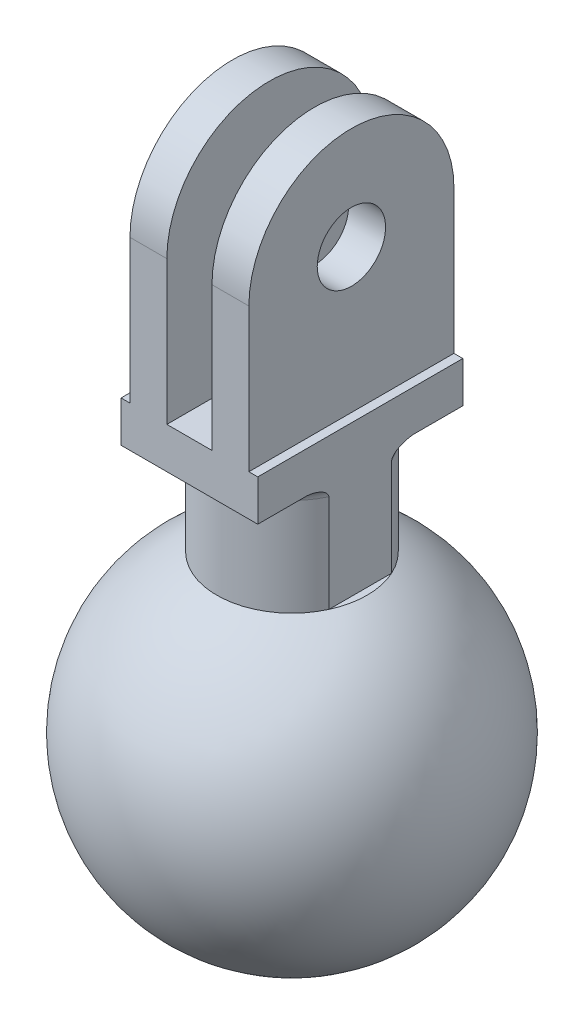
from build123d import *

# Parameters (mm, degrees)
SKETCH2_W           = 10
SKETCH2_H           = 15
BOSS_EXTRUDE1_DEPTH = 3
SKETCH3_W           = 2.7
SKETCH3_H           = 15
BOSS_EXTRUDE2_DEPTH = 18
SKETCH4_R           = 2.5
CUT_EXTRUDE1_DEPTH  = 39.541399757
SKETCH5_W           = 3.267109453
SKETCH5_H           = 13.055369116
SKETCH5_W_2         = 2.399629859
SKETCH5_H_2         = 12.441962392
CUT_EXTRUDE2_DEPTH  = 11


with BuildPart() as part:
    # Sketch1 → Revolve1 (revolve)
    with BuildSketch(Plane.XY, mode=Mode.PRIVATE) as revolve1_sk:
        with BuildLine():
            Line((5.5, 0), (0, 0))
            Line((0, 0), (0, -32.147270417))
            ThreePointArc((0, -32.147270417), (12.382857794, -22.267701741), (5.5, -8))
            Line((5.5, -8), (5.5, -0.86171942))
            Line((5.5, -0.86171942), (5.5, 0))
        make_face()
        with BuildLine():
            Line((6.36171942, 0), (5.5, 0))
            Line((5.5, 0), (5.5, -0.86171942))
            ThreePointArc((5.5, -0.86171942), (5.77082934, -0.27082934), (6.36171942, 0))
        make_face()
    revolve(revolve1_sk.sketch.rotate(Axis((0, 0, 0), (0, -1, 0)), 90), axis=Axis((0, 0, 0), (0, -1, 0)))

    # Sketch2 → Boss-Extrude1 (add)
    with BuildSketch(Plane(origin=(0, 0, 0), x_dir=(1, 0, 0), z_dir=(0, 1, 0))):
        Rectangle(SKETCH2_W, SKETCH2_H)
    extrude(amount=BOSS_EXTRUDE1_DEPTH)

    # Sketch3 → Boss-Extrude2 (add)
    with BuildSketch(Plane(origin=(0, 3, 0), x_dir=(1, 0, 0), z_dir=(0, 1, 0))):
        with Locations((-3, 0)):
            Rectangle(SKETCH3_W, SKETCH3_H)
        with Locations((3, 0)):
            Rectangle(SKETCH3_W, SKETCH3_H)
    extrude(amount=BOSS_EXTRUDE2_DEPTH)

    # Sketch4 → Cut-Extrude1 (cut, through all)
    with BuildSketch(Plane.ZY.offset(4.35)):
        with Locations((0, 13.5)):
            Circle(SKETCH4_R)
        with BuildLine():
            Line((-7.5, 21), (-7.5, 13.5))
            ThreePointArc((-7.5, 13.5), (-5.303300859, 18.803300859), (0, 21))
            Line((0, 21), (-7.5, 21))
        make_face()
        with BuildLine():
            Line((7.5, 21), (0, 21))
            ThreePointArc((0, 21), (5.303300859, 18.803300859), (7.5, 13.5))
            Line((7.5, 13.5), (7.5, 21))
        make_face()
    extrude(amount=-CUT_EXTRUDE1_DEPTH, mode=Mode.SUBTRACT)

    # Sketch5 → Cut-Extrude2 (cut)
    with BuildSketch(Plane(origin=(0, 3, 0), x_dir=(1, 0, 0), z_dir=(0, 1, 0))):
        with Locations((6.633554726, 0.972315442)):
            Rectangle(SKETCH5_W, SKETCH5_H)
        with Locations((-6.19981493, 1.279018804)):
            Rectangle(SKETCH5_W_2, SKETCH5_H_2)
    extrude(amount=-CUT_EXTRUDE2_DEPTH, mode=Mode.SUBTRACT)


solid = part.part
